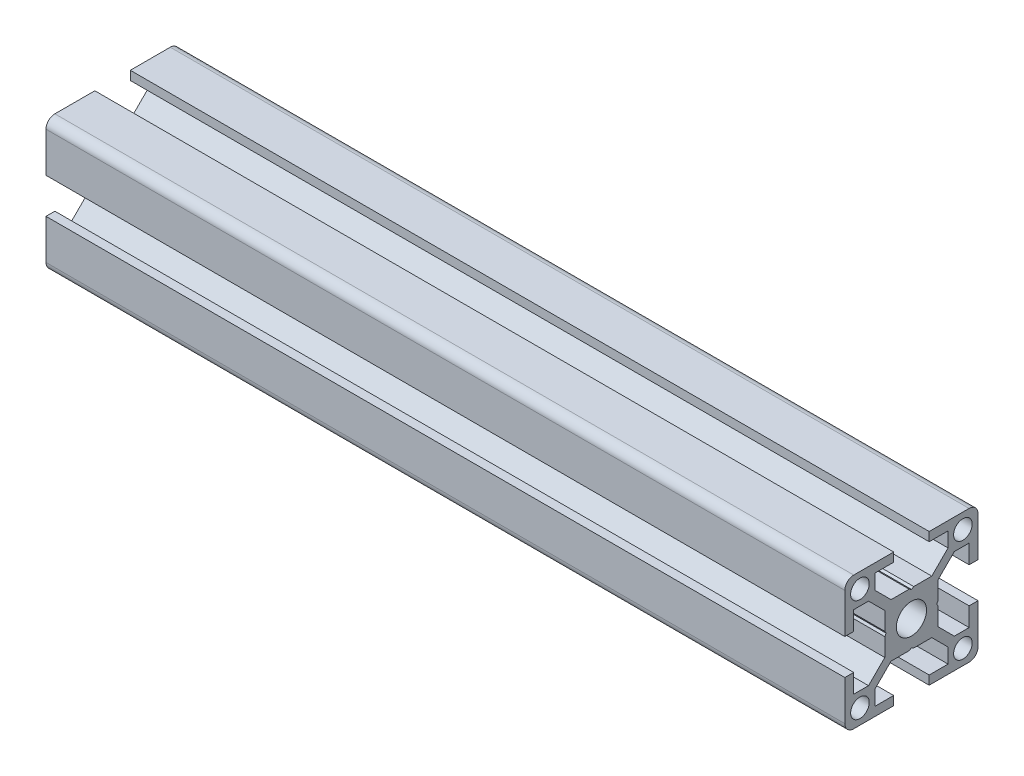
from build123d import *

# Parameters (mm, degrees)
SKETCH11_R              = 3.4
SKETCH11_R_2            = 2.1
NH_H_NH_30X30X2_1_DEPTH = 180


with BuildPart() as part:
    # Sketch11 → Ðnh hình 30X30X2(1) (new body)
    with BuildSketch(Plane.YZ):
        with BuildLine():
            Line((13, -4), (13, -8.25))
            Line((13, -8.25), (9.664213562, -8.25))
            Line((9.664213562, -8.25), (6, -4.585786438))
            Line((6, -4.585786438), (6, -0.519615242))
            Line((6, -0.519615242), (5.7, 0))
            Line((5.7, 0), (6, 0.519615242))
            Line((6, 0.519615242), (6, 4.585786438))
            Line((6, 4.585786438), (9.664213562, 8.25))
            Line((9.664213562, 8.25), (13, 8.25))
            Line((13, 8.25), (13, 4))
            Line((13, 4), (15, 4))
            Line((15, 4), (15, 13))
            ThreePointArc((15, 13), (14.414213562, 14.414213562), (13, 15))
            Line((13, 15), (4, 15))
            Line((4, 15), (4, 13))
            Line((4, 13), (8.25, 13))
            Line((8.25, 13), (8.25, 9.664213562))
            Line((8.25, 9.664213562), (4.585786438, 6))
            Line((4.585786438, 6), (0.519615242, 6))
            Line((0.519615242, 6), (0, 5.7))
            Line((0, 5.7), (-0.519615242, 6))
            Line((-0.519615242, 6), (-4.585786438, 6))
            Line((-4.585786438, 6), (-8.25, 9.664213562))
            Line((-8.25, 9.664213562), (-8.25, 13))
            Line((-8.25, 13), (-4, 13))
            Line((-4, 13), (-4, 15))
            Line((-4, 15), (-13, 15))
            ThreePointArc((-13, 15), (-14.414213562, 14.414213562), (-15, 13))
            Line((-15, 13), (-15, 4))
            Line((-15, 4), (-13, 4))
            Line((-13, 4), (-13, 8.25))
            Line((-13, 8.25), (-9.664213562, 8.25))
            Line((-9.664213562, 8.25), (-6, 4.585786438))
            Line((-6, 4.585786438), (-6, 0.519615242))
            Line((-6, 0.519615242), (-5.7, 0))
            Line((-5.7, 0), (-6, -0.519615242))
            Line((-6, -0.519615242), (-6, -4.585786438))
            Line((-6, -4.585786438), (-9.664213562, -8.25))
            Line((-9.664213562, -8.25), (-13, -8.25))
            Line((-13, -8.25), (-13, -4))
            Line((-13, -4), (-15, -4))
            Line((-15, -4), (-15, -13))
            ThreePointArc((-15, -13), (-14.414213562, -14.414213562), (-13, -15))
            Line((-13, -15), (-4, -15))
            Line((-4, -15), (-4, -13))
            Line((-4, -13), (-8.25, -13))
            Line((-8.25, -13), (-8.25, -9.664213562))
            Line((-8.25, -9.664213562), (-4.585786438, -6))
            Line((-4.585786438, -6), (-0.519615242, -6))
            Line((-0.519615242, -6), (0, -5.7))
            Line((0, -5.7), (0.519615242, -6))
            Line((0.519615242, -6), (4.585786438, -6))
            Line((4.585786438, -6), (8.25, -9.664213562))
            Line((8.25, -9.664213562), (8.25, -13))
            Line((8.25, -13), (4, -13))
            Line((4, -13), (4, -15))
            Line((4, -15), (13, -15))
            ThreePointArc((13, -15), (14.414213562, -14.414213562), (15, -13))
            Line((15, -13), (15, -4))
            Line((15, -4), (13, -4))
        make_face()
        Circle(SKETCH11_R, mode=Mode.SUBTRACT)
        with Locations((11.6, -11.6)):
            Circle(SKETCH11_R_2, mode=Mode.SUBTRACT)
        with Locations((11.6, 11.6)):
            Circle(SKETCH11_R_2, mode=Mode.SUBTRACT)
        with Locations((-11.6, 11.6)):
            Circle(SKETCH11_R_2, mode=Mode.SUBTRACT)
        with Locations((-11.6, -11.6)):
            Circle(SKETCH11_R_2, mode=Mode.SUBTRACT)
    extrude(amount=NH_H_NH_30X30X2_1_DEPTH)


solid = part.part
